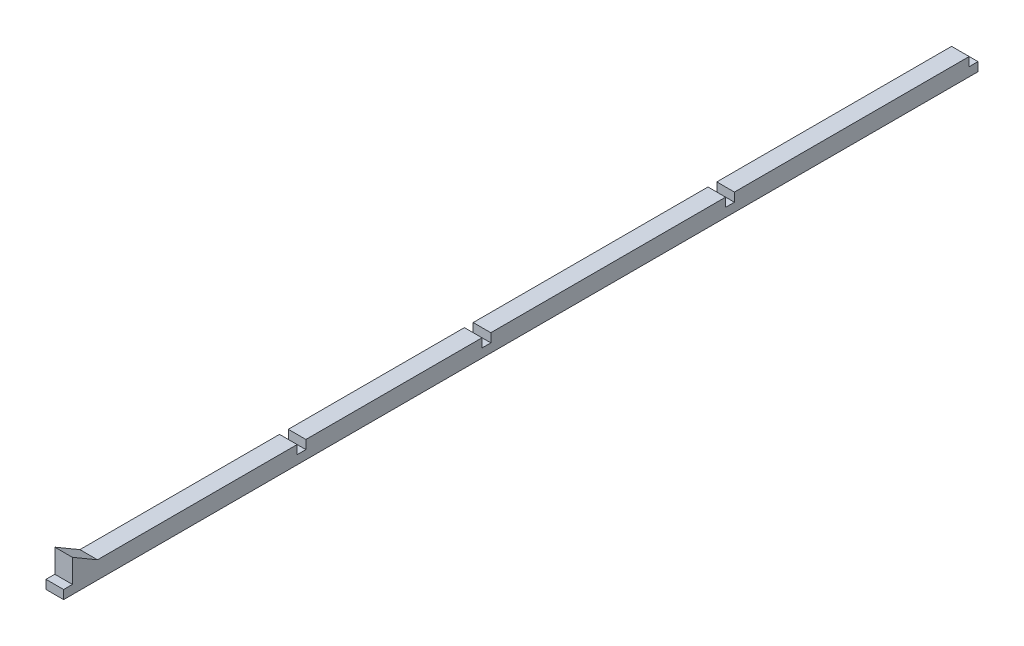
from build123d import *

# Parameters (mm, degrees)
EXTRUDE_1_DEPTH = 6


with BuildPart() as part:
    # Эскиз1 → Бобышка-Вытянуть1 (new body)
    with BuildSketch(Plane(origin=(0, 0, 0), x_dir=(0, 0, -1), z_dir=(1, 0, 0))):
        Polygon((-411.808386433, 0), (-100.248386433, 0), (-100.248386433, 3), (-103.248386433, 3), (-103.248386433, 6), (-183.248386433, 6), (-183.248386433, 3), (-186.248386433, 3), (-186.248386433, 6), (-266.248386433, 6), (-266.248386433, 3), (-269.248386433, 3), (-269.248386433, 6), (-329.248386433, 6), (-329.248386433, 3), (-332.248386433, 3), (-332.248386433, 6), (-400.259443479, 6), (-408.808386433, 11), (-408.808386433, 6), (-408.808386433, 3), (-411.808386433, 3), align=None)
    extrude(amount=EXTRUDE_1_DEPTH)


solid = part.part
